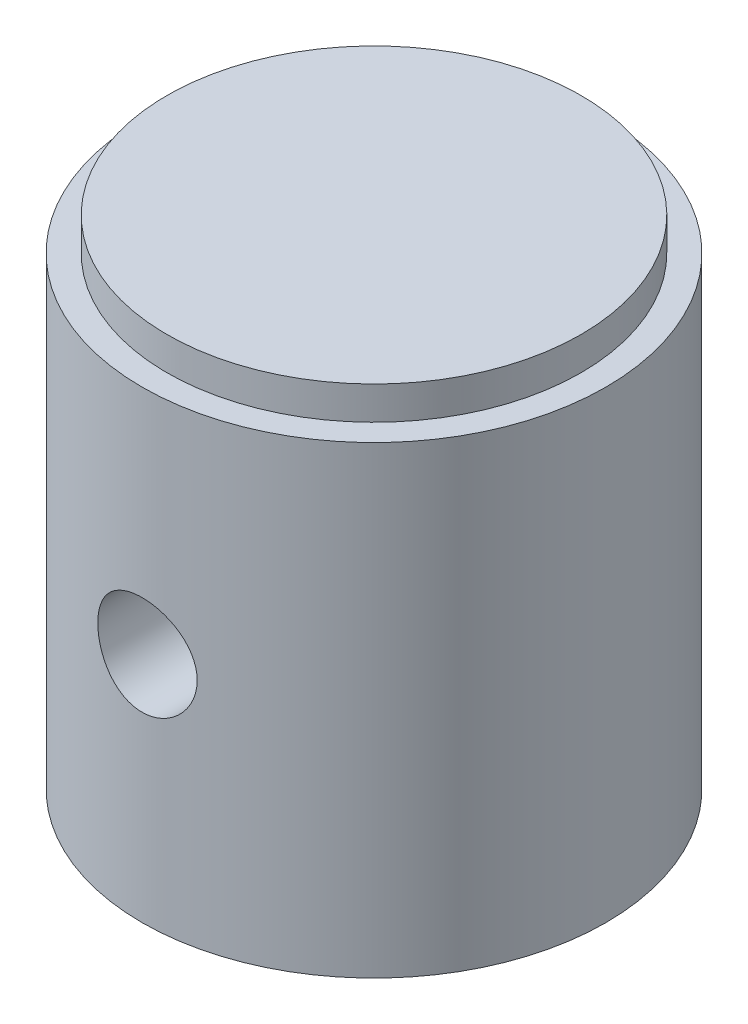
from build123d import *

# Parameters (mm, degrees)
CUT_EXTRUDE1_DEPTH      = 18.027499895
CUT_EXTRUDE1_DEPTH_BACK = 18.027499895
SKETCH2_R               = 1.5


with BuildPart() as part:
    # Sketch1 → Revolve1 (revolve)
    with BuildSketch(Plane.XY, mode=Mode.PRIVATE) as revolve1_sk:
        Polygon((0, 1.14591206), (-6.25, 1.14591206), (-6.25, 0.14591206), (-7, 0.14591206), (-7, -13.85408794), (-6.25, -13.85408794), (-4.75, -9.732871811), (-4.75, -2.85408794), (0, 0), align=None)
    revolve(revolve1_sk.sketch.rotate(Axis((0, -1.14591206, 0), (0, 1, 0)), 180), axis=Axis((0, -1.14591206, 0), (0, 1, 0)))

    # Sketch2 → Cut-Extrude1 (cut, two sides: drawn at the far end of the back side and taken through both)
    with BuildSketch(Plane.XY.offset(-CUT_EXTRUDE1_DEPTH_BACK)):
        with Locations((0, -6.85408794)):
            Circle(SKETCH2_R)
    extrude(amount=CUT_EXTRUDE1_DEPTH + CUT_EXTRUDE1_DEPTH_BACK, mode=Mode.SUBTRACT)


solid = part.part
